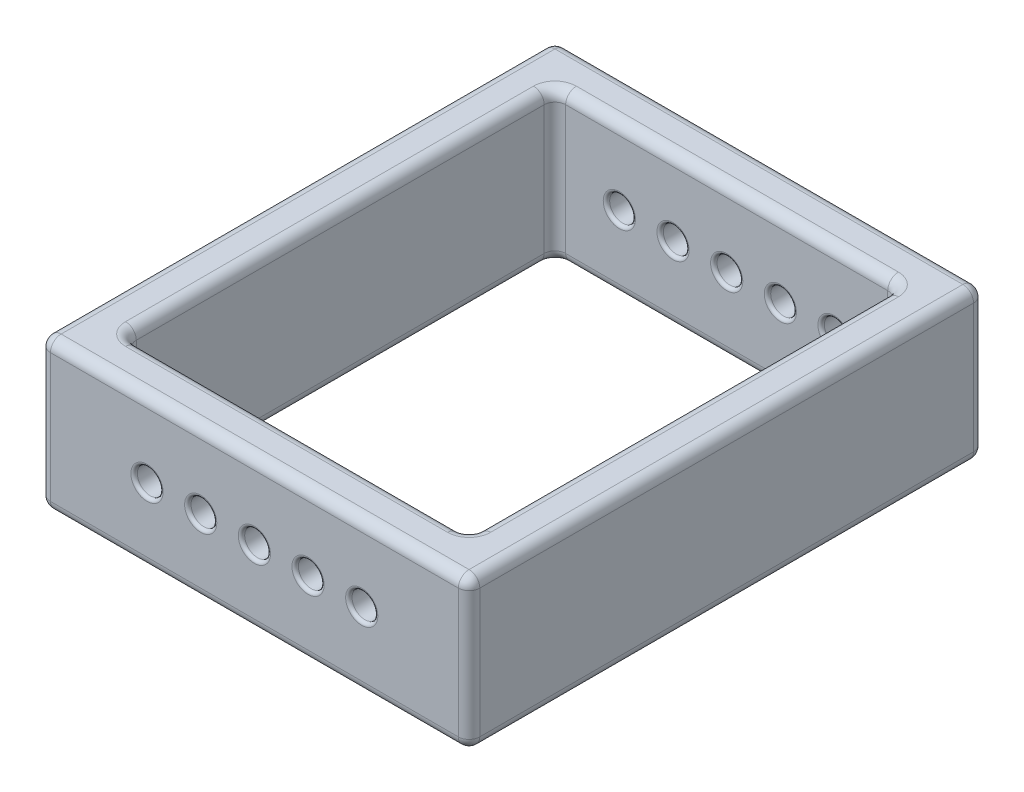
from build123d import *

# Parameters (mm, degrees)
SKETCH1_W                  = 40
SKETCH1_H                  = 14
BOSS_EXTRUDE1_DEPTH        = 48
SKETCH3_W                  = 32
SKETCH3_H                  = 40
CUT_EXTRUDE1_DEPTH         = 48
F_2_4_2_4_DIAMETER_HOLE1_D = 2.4
FILLET1_R                  = 1
FILLET2_R                  = 0.3


with BuildPart() as part:
    # Sketch1 → Boss-Extrude1 (new body)
    with BuildSketch(Plane.XY):
        Rectangle(SKETCH1_W, SKETCH1_H)
    extrude(amount=BOSS_EXTRUDE1_DEPTH)

    # Sketch3 → Cut-Extrude1 (cut)
    with BuildSketch(Plane(origin=(0, 7, 0), x_dir=(1, 0, 0), z_dir=(0, 1, 0))):
        with Locations((0, -24)):
            Rectangle(SKETCH3_W, SKETCH3_H)
    extrude(amount=-CUT_EXTRUDE1_DEPTH, mode=Mode.SUBTRACT)

    # Ø2.4 (2.4) Diameter Hole1 (through all)
    with Locations(Plane.XY.offset(48)):
        with Locations((-10, 0), (-5, 0), (0, 0), (5, 0), (10, 0)):
            Hole(F_2_4_2_4_DIAMETER_HOLE1_D / 2)

    # Fillet1
    fillet1_edges = [part.edges().sort_by_distance(p)[0] for p in [
        (20, 0, 48),
        (0, 7, 48),
        (-16, -7, 24),
        (-16, 0, 44),
        (0, -7, 4),
        (-16, 0, 4),
        (16, -7, 24),
        (16, 0, 4),
        (0, -7, 44),
        (16, 0, 44),
        (-16, 7, 24),
        (0, 7, 44),
        (16, 7, 24),
        (0, 7, 4),
        (-20, 0, 48),
        (0, 7, 0),
        (20, 0, 0),
        (0, -7, 0),
        (-20, 0, 0),
        (-20, 7, 24),
        (20, 7, 24),
        (20, -7, 24),
        (-20, -7, 24),
        (0, -7, 48),
    ]]
    fillet(fillet1_edges, radius=FILLET1_R)

    # Fillet2
    fillet2_edges = [part.edges().sort_by_distance(p)[0] for p in [
        (11.2, 0, 0),
        (11.2, 0, 4),
        (11.2, 0, 44),
        (11.2, 0, 48),
        (6.2, 0, 0),
        (6.2, 0, 4),
        (6.2, 0, 44),
        (6.2, 0, 48),
        (1.2, 0, 44),
        (1.2, 0, 0),
        (1.2, 0, 4),
        (1.2, 0, 48),
        (-3.8, 0, 44),
        (-3.8, 0, 0),
        (-3.8, 0, 4),
        (-3.8, 0, 48),
        (-8.8, 0, 0),
        (-8.8, 0, 4),
        (-8.8, 0, 44),
        (-8.8, 0, 48),
    ]]
    fillet(fillet2_edges, radius=FILLET2_R)


solid = part.part
